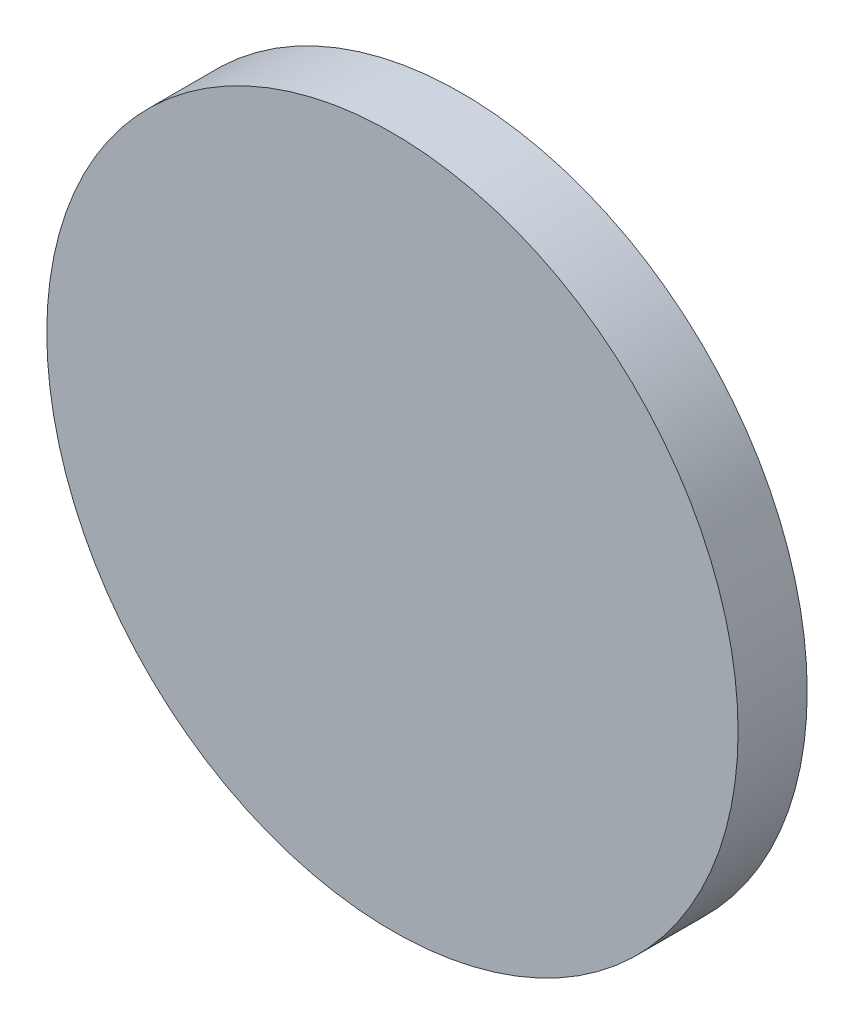
from build123d import *

# Parameters (mm, degrees)
SKETCH_1_R      = 500
EXTRUDE_1_DEPTH = 100


with BuildPart() as part:
    # 草图1 → 凸台-拉伸1 (new body)
    with BuildSketch(Plane.XY):
        Circle(SKETCH_1_R)
    extrude(amount=EXTRUDE_1_DEPTH)


solid = part.part
